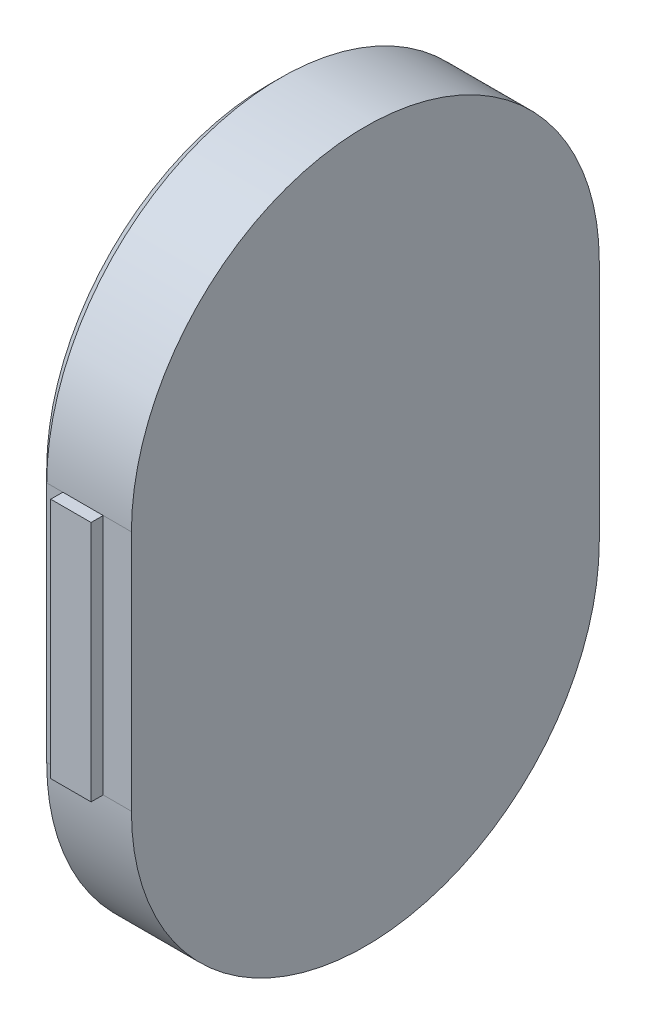
from build123d import *

# Parameters (mm, degrees)
BOSS_EXTRUDE1_START = -63
BOSS_EXTRUDE1_DEPTH = 2.4
CHAMFER1_SIZE       = 0.3
BOSS_EXTRUDE2_START = 61.3
SKETCH2_W           = 1
SKETCH2_H           = 6
BOSS_EXTRUDE2_DEPTH = 0.31
BOSS_EXTRUDE3_START = 73.19
SKETCH3_W           = 1
SKETCH3_H           = 6
BOSS_EXTRUDE3_DEPTH = 0.31
BOSS_EXTRUDE4_START = 65.9
SKETCH4_W           = 0.7
SKETCH4_H           = 1.3
BOSS_EXTRUDE4_DEPTH = 3


with BuildPart() as part:
    # Sketch1 → Boss-Extrude1 (new body)
    with BuildSketch(Plane(origin=(0, 0, 0), x_dir=(0, 0, -1), z_dir=(1, 0, 0)).offset(BOSS_EXTRUDE1_START)):
        with BuildLine():
            Line((-73.2, 110), (-73.2, 116))
            ThreePointArc((-73.2, 116), (-71.501219331, 120.101219331), (-67.4, 121.8))
            ThreePointArc((-67.4, 121.8), (-63.298780669, 120.101219331), (-61.6, 116))
            Line((-61.6, 116), (-61.6, 110))
            ThreePointArc((-61.6, 110), (-63.298780669, 105.898780669), (-67.4, 104.2))
            ThreePointArc((-67.4, 104.2), (-71.501219331, 105.898780669), (-73.2, 110))
        make_face()
    extrude(amount=BOSS_EXTRUDE1_DEPTH)

    # Chamfer1
    chamfer1_edges = [part.edges().sort_by_distance(p)[0] for p in [
        (-63, 104.2, 67.4),
        (-63, 113, 61.6),
        (-63, 113, 73.2),
        (-63, 121.8, 67.4),
    ]]
    chamfer(chamfer1_edges, length=CHAMFER1_SIZE)

    # Sketch2 → Boss-Extrude2 (add)
    with BuildSketch(Plane.XY.offset(BOSS_EXTRUDE2_START)):
        with Locations((-61.8, 113)):
            Rectangle(SKETCH2_W, SKETCH2_H)
    extrude(amount=BOSS_EXTRUDE2_DEPTH)

    # Sketch3 → Boss-Extrude3 (add)
    with BuildSketch(Plane.XY.offset(BOSS_EXTRUDE3_START)):
        with Locations((-61.8, 113)):
            Rectangle(SKETCH3_W, SKETCH3_H)
    extrude(amount=BOSS_EXTRUDE3_DEPTH)


with BuildPart() as body_2:
    # Sketch4 → Boss-Extrude4 (new body)
    with BuildSketch(Plane.XY.offset(BOSS_EXTRUDE4_START)):
        with Locations((-62.75, 104.75)):
            Rectangle(SKETCH4_W, SKETCH4_H)
    extrude(amount=BOSS_EXTRUDE4_DEPTH)


with BuildPart() as part_1:
    add(part.part)

    # Combine1: cut body 2
    add(body_2.part, mode=Mode.SUBTRACT)


solid = part_1.part
